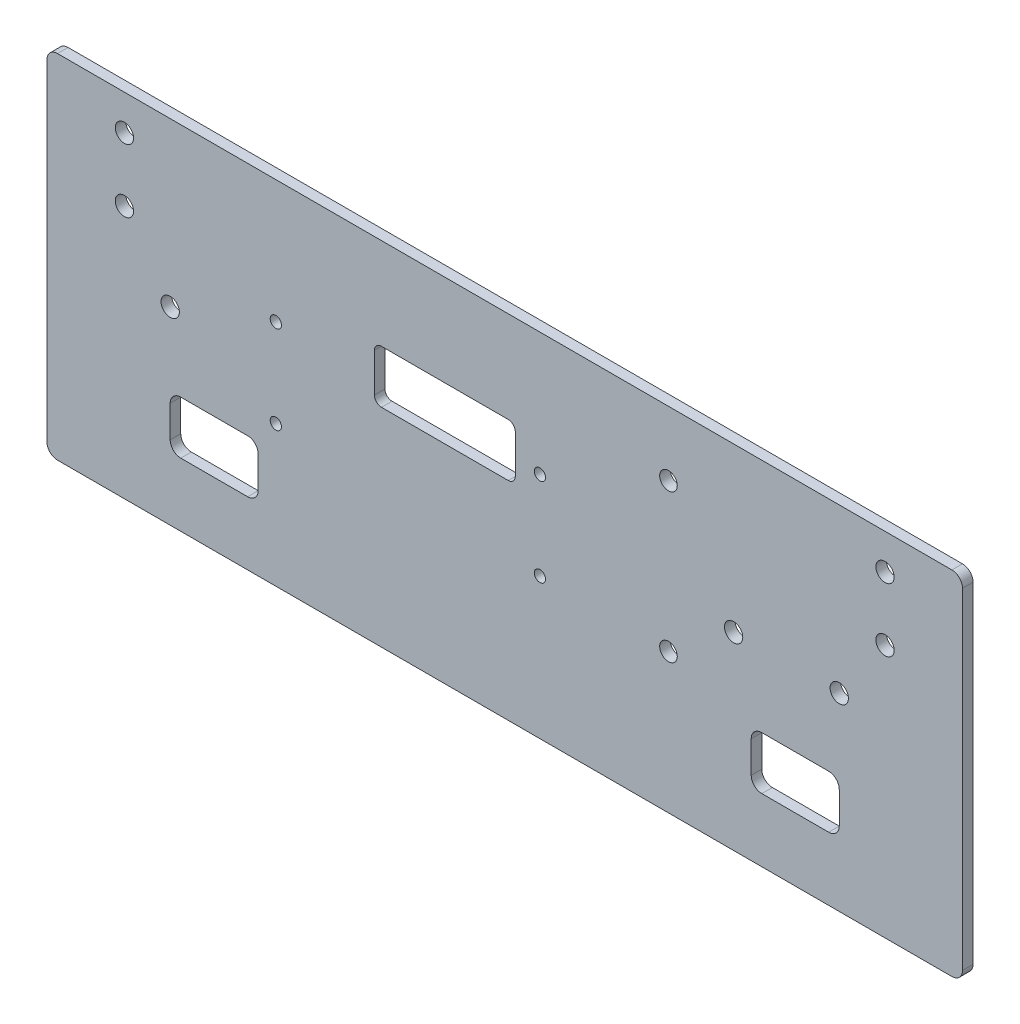
from build123d import *

# Parameters (mm, degrees)
SKETCH_1_W          = 260
SKETCH_1_H          = 100
EXTRUDE_1_DEPTH     = 3
FILLET_1_R          = 3
SKETCH_4_W          = 25
SKETCH_4_H          = 15
CUT_EXTRUDE_3_DEPTH = 500
FILLET_2_R          = 3
SKETCH_6_R          = 1.6
SKETCH_6_W          = 40
SKETCH_6_H          = 15
CUT_EXTRUDE_5_DEPTH = 10
FILLET_4_R          = 2
SKETCH_7_R          = 2.5
CUT_EXTRUDE_6_DEPTH = 10
SKETCH_8_R          = 2.6
CUT_EXTRUDE_7_DEPTH = 10
SKETCH_9_R          = 2.6
CUT_EXTRUDE_8_DEPTH = 10


with BuildPart() as part:
    # 草图1 → 凸台-拉伸1 (new body)
    with BuildSketch(Plane.XY):
        Rectangle(SKETCH_1_W, SKETCH_1_H)
    extrude(amount=EXTRUDE_1_DEPTH)

    # 圆角1
    fillet_1_edges = [part.edges().sort_by_distance(p)[0] for p in [
        (-130, 50, 1.5),
        (130, 50, 1.5),
        (130, -50, 1.5),
        (-130, -50, 1.5),
    ]]
    fillet(fillet_1_edges, radius=FILLET_1_R)

    # 草图4 → 切除-拉伸3 (cut)
    with BuildSketch(Plane.XY.offset(3)):
        with Locations((-82.5, -24.5)):
            Rectangle(SKETCH_4_W, SKETCH_4_H)
        with Locations((82.5, -24.5)):
            Rectangle(SKETCH_4_W, SKETCH_4_H)
    extrude(amount=-CUT_EXTRUDE_3_DEPTH, mode=Mode.SUBTRACT)

    # 圆角2
    fillet_2_edges = [part.edges().sort_by_distance(p)[0] for p in [
        (-95, -32, 1.5),
        (-95, -17, 1.5),
        (-70, -17, 1.5),
        (-70, -32, 1.5),
        (70, -17, 1.5),
        (95, -17, 1.5),
        (95, -32, 1.5),
        (70, -32, 1.5),
    ]]
    fillet(fillet_2_edges, radius=FILLET_2_R)

    # 草图6 → 切除-拉伸5 (cut)
    with BuildSketch(Plane.XY.offset(3)):
        with Locations((-65, 15)):
            Circle(SKETCH_6_R)
        with Locations((10, 15)):
            Circle(SKETCH_6_R)
        with Locations((10, -10)):
            Circle(SKETCH_6_R)
        with Locations((-65, -10)):
            Circle(SKETCH_6_R)
        with Locations((-17, 16.5)):
            Rectangle(SKETCH_6_W, SKETCH_6_H)
    extrude(amount=-CUT_EXTRUDE_5_DEPTH, mode=Mode.SUBTRACT)

    # 圆角4
    fillet_4_edges = [part.edges().sort_by_distance(p)[0] for p in [
        (-37, 9, 1.5),
        (-37, 24, 1.5),
        (3, 24, 1.5),
        (3, 9, 1.5),
    ]]
    fillet(fillet_4_edges, radius=FILLET_4_R)

    # 草图7 → 切除-拉伸6 (cut)
    with BuildSketch(Plane.XY.offset(3)):
        with Locations((46.5, 31.7)):
            Circle(SKETCH_7_R)
        with Locations((46.5, -10.3)):
            Circle(SKETCH_7_R)
    extrude(amount=-CUT_EXTRUDE_6_DEPTH, mode=Mode.SUBTRACT)

    # 草图8 → 切除-拉伸7 (cut)
    with BuildSketch(Plane.XY.offset(3)):
        with Locations((-108, 40)):
            Circle(SKETCH_8_R)
        with Locations((108, 40)):
            Circle(SKETCH_8_R)
        with Locations((-108, 22)):
            Circle(SKETCH_8_R)
        with Locations((108, 22)):
            Circle(SKETCH_8_R)
        with Locations((-95, 3.7)):
            Circle(SKETCH_8_R)
        with Locations((95, 3.7)):
            Circle(SKETCH_8_R)
    extrude(amount=-CUT_EXTRUDE_7_DEPTH, mode=Mode.SUBTRACT)

    # 草图9 → 切除-拉伸8 (cut)
    with BuildSketch(Plane.XY.offset(3)):
        with Locations((65, 3.7)):
            Circle(SKETCH_9_R)
    extrude(amount=-CUT_EXTRUDE_8_DEPTH, mode=Mode.SUBTRACT)


solid = part.part
